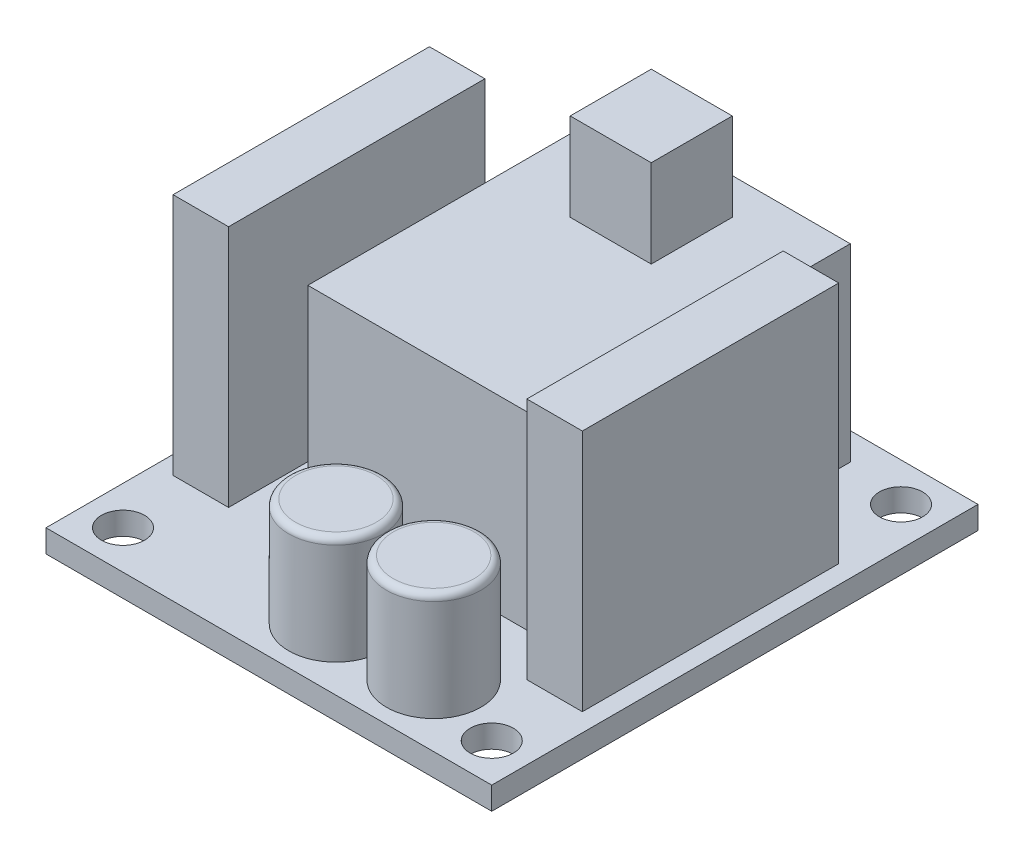
from build123d import *

# Parameters (mm, degrees)
SKETCH1_W           = 33
SKETCH1_H           = 36
SKETCH1_R           = 1.6
BOSS_EXTRUDE1_DEPTH = 1.68
SKETCH2_W           = 17.413087774
SKETCH2_H           = 22.744623076
BOSS_EXTRUDE2_DEPTH = 14
SKETCH3_W           = 6
SKETCH3_H           = 6
BOSS_EXTRUDE3_DEPTH = 6.5
SKETCH4_W           = 4.108706104
SKETCH4_H           = 18.978309146
BOSS_EXTRUDE4_DEPTH = 18
SKETCH5_R           = 3.495385022
BOSS_EXTRUDE5_DEPTH = 8
FILLET1_R           = 0.5


with BuildPart() as part:
    # Sketch1 → Boss-Extrude1 (new body)
    with BuildSketch(Plane(origin=(0, 0, 0), x_dir=(1, 0, 0), z_dir=(0, 1, 0))):
        Rectangle(SKETCH1_W, SKETCH1_H)
        with Locations(Location((-13.65, 15.15, 0), (0, 0, 270))):
            Circle(SKETCH1_R, mode=Mode.SUBTRACT)
        with Locations(Location((13.65, 15.15, 0), (0, 0, 270))):
            Circle(SKETCH1_R, mode=Mode.SUBTRACT)
        with Locations(Location((13.65, -15.15, 0), (0, 0, 270))):
            Circle(SKETCH1_R, mode=Mode.SUBTRACT)
        with Locations(Location((-13.65, -15.15, 0), (0, 0, 270))):
            Circle(SKETCH1_R, mode=Mode.SUBTRACT)
    extrude(amount=BOSS_EXTRUDE1_DEPTH)

    # Sketch2 → Boss-Extrude2 (add)
    with BuildSketch(Plane(origin=(0, 1.68, 0), x_dir=(1, 0, 0), z_dir=(0, 1, 0))):
        with Locations((0.354620467, 4.610066075)):
            Rectangle(SKETCH2_W, SKETCH2_H)
    extrude(amount=BOSS_EXTRUDE2_DEPTH)

    # Sketch3 → Boss-Extrude3 (add)
    with BuildSketch(Plane(origin=(0, 15.68, 0), x_dir=(1, 0, 0), z_dir=(0, 1, 0))):
        with Locations((0, 10.308450136)):
            Rectangle(SKETCH3_W, SKETCH3_H)
    extrude(amount=BOSS_EXTRUDE3_DEPTH)

    # Sketch4 → Boss-Extrude4 (add)
    with BuildSketch(Plane(origin=(0, 1.68, 0), x_dir=(1, 0, 0), z_dir=(0, 1, 0))):
        with Locations((-13.096500706, -0.452446803)):
            Rectangle(SKETCH4_W, SKETCH4_H)
    boss_extrude4 = extrude(amount=BOSS_EXTRUDE4_DEPTH)

    # Mirror1: Boss-Extrude4 across plane
    add(boss_extrude4.mirror(Plane(origin=(0, 0, 0), x_dir=(0, 0, 1), z_dir=(1, 0, 0))))

    # Sketch5 → Boss-Extrude5 (add)
    with BuildSketch(Plane(origin=(0, 1.68, 0), x_dir=(1, 0, 0), z_dir=(0, 1, 0))):
        with Locations(Location((7.61678506, -13.414271653, 0), (0, 0, 90))):
            Circle(SKETCH5_R)
        with Locations(Location((0.380282147, -13.414271653, 0), (0, 0, 90))):
            Circle(SKETCH5_R)
    extrude(amount=BOSS_EXTRUDE5_DEPTH)

    # Fillet1
    fillet1_edges = [part.edges().sort_by_distance(p)[0] for p in [
        (7.61678506, 9.68, 16.909656675),
        (0.380282147, 9.68, 16.909656675),
    ]]
    fillet(fillet1_edges, radius=FILLET1_R)


solid = part.part
